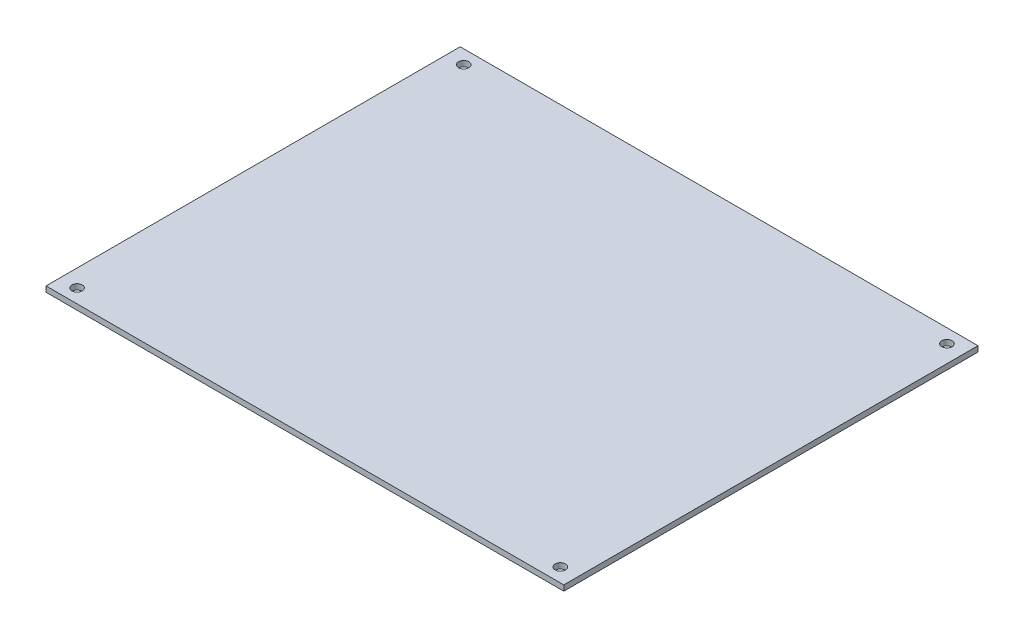
from build123d import *

# Parameters (mm, degrees)
SKETCH1_W           = 150
SKETCH1_H           = 120
SKETCH1_R           = 1.5
BOSS_EXTRUDE1_DEPTH = 1.6


with BuildPart() as part:
    # Sketch1 → Boss-Extrude1 (new body)
    with BuildSketch(Plane(origin=(0, 0, 0), x_dir=(1, 0, 0), z_dir=(0, 1, 0))):
        Rectangle(SKETCH1_W, SKETCH1_H)
        with Locations(Location((70, 56, 0), (0, 0, 270))):
            Circle(SKETCH1_R, mode=Mode.SUBTRACT)
        with Locations(Location((70, -56, 0), (0, 0, 270))):
            Circle(SKETCH1_R, mode=Mode.SUBTRACT)
        with Locations(Location((-70, -56, 0), (0, 0, 90))):
            Circle(SKETCH1_R, mode=Mode.SUBTRACT)
        with Locations(Location((-70, 56, 0), (0, 0, 90))):
            Circle(SKETCH1_R, mode=Mode.SUBTRACT)
    extrude(amount=BOSS_EXTRUDE1_DEPTH)


solid = part.part
